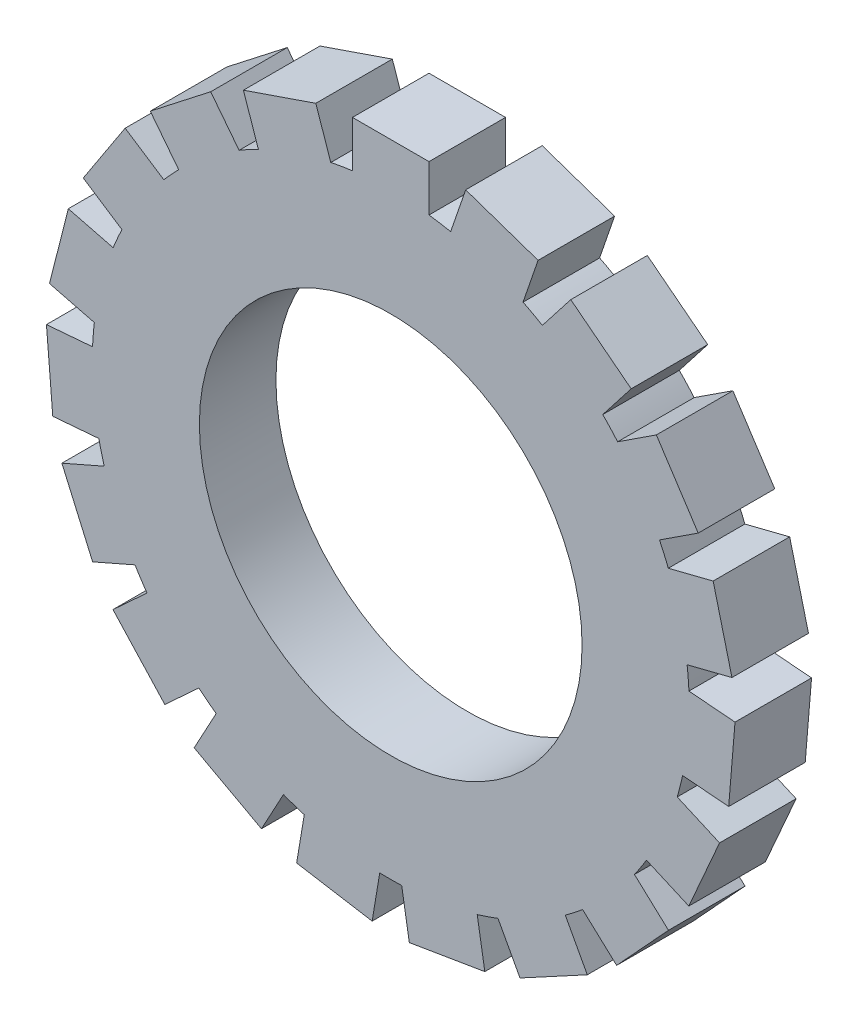
from build123d import *

# Parameters (mm, degrees)
SKETCH1_R           = 39
SKETCH1_R_2         = 25
BOSS_EXTRUDE1_DEPTH = 10


with BuildPart() as part:
    # Sketch1 → Boss-Extrude1 (new body)
    # profile 1 of 20: a face of its own
    with BuildSketch(Plane.XY):
        Circle(SKETCH1_R)
        Circle(SKETCH1_R_2, mode=Mode.SUBTRACT)
    # profile 2 of 20: a face of its own
    with BuildSketch(Plane.XY):
        with BuildLine():
            ThreePointArc((-38.722045261, 4.647925426), (-37.806610372, 9.573933998), (-36.26719039, 14.341928085))
            Line((-36.26719039, 14.341928085), (-42.125470405, 15.825446064))
            Line((-42.125470405, 15.825446064), (-44.580325277, 6.131443405))
            Line((-44.580325277, 6.131443405), (-38.722045261, 4.647925426))
        make_face()
    # profile 3 of 20: a face of its own
    with BuildSketch(Plane.XY):
        with BuildLine():
            ThreePointArc((-35.114799123, 16.969115549), (-32.649492652, 21.330978167), (-29.645317542, 25.340780332))
            Line((-29.645317542, 25.340780332), (-34.704482287, 28.646097626))
            Line((-34.704482287, 28.646097626), (-40.173963868, 20.274432843))
            Line((-40.173963868, 20.274432843), (-35.114799123, 16.969115549))
        make_face()
    # profile 4 of 20: a face of its own
    with BuildSketch(Plane.XY):
        with BuildLine():
            ThreePointArc((-27.702319638, 27.451438699), (-23.954295795, 30.776479866), (-19.810914544, 33.593565826))
            Line((-19.810914544, 33.593565826), (-23.522725017, 38.36250002))
            Line((-23.522725017, 38.36250002), (-31.414130111, 32.220372893))
            Line((-31.414130111, 32.220372893), (-27.702319638, 27.451438699))
        make_face()
    # profile 5 of 20: a face of its own
    with BuildSketch(Plane.XY):
        with BuildLine():
            ThreePointArc((-17.287863974, 34.958972514), (-12.663279299, 36.886872426), (-7.829691557, 38.205967206))
            Line((-7.829691557, 38.205967206), (-9.791915499, 43.921730281))
            Line((-9.791915499, 43.921730281), (-19.250087916, 40.674735589))
            Line((-19.250087916, 40.674735589), (-17.287863974, 34.958972514))
        make_face()
    # profile 6 of 20: a face of its own
    with BuildSketch(Plane.XY):
        with BuildLine():
            Line((9.791915499, 43.921730281), (7.829691557, 38.205967206))
            ThreePointArc((7.829691557, 38.205967206), (12.663279299, 36.886872426), (17.287863974, 34.958972514))
            Line((17.287863974, 34.958972514), (19.250087916, 40.674735589))
            Line((19.250087916, 40.674735589), (9.791915499, 43.921730281))
        make_face()
    # profile 7 of 20: a face of its own
    with BuildSketch(Plane.XY):
        with BuildLine():
            Line((5, 44.72135955), (-5, 44.72135955))
            Line((-5, 44.72135955), (-5, 38.678159212))
            ThreePointArc((-5, 38.678159212), (0, 39), (5, 38.678159212))
            Line((5, 38.678159212), (5, 44.72135955))
        make_face()
    # profile 8 of 20: a face of its own
    with BuildSketch(Plane.XY):
        with BuildLine():
            Line((23.522725017, 38.36250002), (19.810914544, 33.593565826))
            ThreePointArc((19.810914544, 33.593565826), (23.954295795, 30.776479866), (27.702319638, 27.451438699))
            Line((27.702319638, 27.451438699), (31.414130111, 32.220372893))
            Line((31.414130111, 32.220372893), (23.522725017, 38.36250002))
        make_face()
    # profile 9 of 20: a face of its own
    with BuildSketch(Plane.XY):
        with BuildLine():
            Line((34.704482287, 28.646097626), (29.645317542, 25.340780332))
            ThreePointArc((29.645317542, 25.340780332), (32.649492652, 21.330978167), (35.114799123, 16.969115549))
            Line((35.114799123, 16.969115549), (40.173963868, 20.274432843))
            Line((40.173963868, 20.274432843), (34.704482287, 28.646097626))
        make_face()
    # profile 10 of 20: a face of its own
    with BuildSketch(Plane.XY):
        with BuildLine():
            Line((42.125470405, 15.825446064), (36.26719039, 14.341928085))
            ThreePointArc((36.26719039, 14.341928085), (37.806610372, 9.573933998), (38.722045261, 4.647925426))
            Line((38.722045261, 4.647925426), (44.580325277, 6.131443405))
            Line((44.580325277, 6.131443405), (42.125470405, 15.825446064))
        make_face()
    # profile 11 of 20: a face of its own
    with BuildSketch(Plane.XY):
        with BuildLine():
            Line((44.981510161, 1.289861865), (38.958950416, 1.788905393))
            ThreePointArc((38.958950416, 1.788905393), (38.989736253, 0.894688154), (39, 0))
            ThreePointArc((39, 0), (38.782683774, -4.111379241), (38.133156961, -8.176939537))
            Line((38.133156961, -8.176939537), (44.155716706, -8.675983065))
            Line((44.155716706, -8.675983065), (44.981510161, 1.289861865))
        make_face()
    # profile 12 of 20: a face of its own
    with BuildSketch(Plane.XY):
        with BuildLine():
            Line((42.963105331, -13.385498882), (37.428903653, -10.957972956))
            ThreePointArc((37.428903653, -10.957972956), (35.71515974, -15.666121561), (33.411949407, -20.115706223))
            Line((33.411949407, -20.115706223), (38.946151084, -22.543232149))
            Line((38.946151084, -22.543232149), (42.963105331, -13.385498882))
        make_face()
    # profile 13 of 20: a face of its own
    with BuildSketch(Plane.XY):
        with BuildLine():
            Line((36.288981397, -26.610333128), (31.842854411, -22.517384905))
            ThreePointArc((31.842854411, -22.517384905), (28.693232516, -26.413981293), (25.070038695, -29.874624012))
            Line((25.070038695, -29.874624012), (29.516165681, -33.967572235))
            Line((29.516165681, -33.967572235), (36.288981397, -26.610333128))
        make_face()
    # profile 14 of 20: a face of its own
    with BuildSketch(Plane.XY):
        with BuildLine():
            ThreePointArc((-38.133156961, -8.176939537), (-38.866795227, -3.220594473), (-38.958950416, 1.788905393))
            Line((-38.958950416, 1.788905393), (-44.981510161, 1.289861865))
            Line((-44.981510161, 1.289861865), (-44.155716706, -8.675983065))
            Line((-44.155716706, -8.675983065), (-38.133156961, -8.176939537))
        make_face()
    # profile 15 of 20: a face of its own
    with BuildSketch(Plane.XY):
        with BuildLine():
            ThreePointArc((-33.411949407, -20.115706223), (-35.71515974, -15.666121561), (-37.428903653, -10.957972956))
            Line((-37.428903653, -10.957972956), (-42.963105331, -13.385498882))
            Line((-42.963105331, -13.385498882), (-38.946151084, -22.543232149))
            Line((-38.946151084, -22.543232149), (-33.411949407, -20.115706223))
        make_face()
    # profile 16 of 20: a face of its own
    with BuildSketch(Plane.XY):
        with BuildLine():
            ThreePointArc((-25.070038695, -29.874624012), (-28.693232516, -26.413981293), (-31.842854411, -22.517384905))
            Line((-31.842854411, -22.517384905), (-36.288981397, -26.610333128))
            Line((-36.288981397, -26.610333128), (-29.516165681, -33.967572235))
            Line((-29.516165681, -33.967572235), (-25.070038695, -29.874624012))
        make_face()
    # profile 17 of 20: a face of its own
    with BuildSketch(Plane.XY):
        with BuildLine():
            ThreePointArc((-14.011400288, -36.396162737), (-18.561948328, -34.299476297), (-22.8061378, -31.636688806))
            Line((-22.8061378, -31.636688806), (-25.682383247, -36.951524877))
            Line((-25.682383247, -36.951524877), (-16.887645735, -41.710998808))
            Line((-16.887645735, -41.710998808), (-14.011400288, -36.396162737))
        make_face()
    # profile 18 of 20: a face of its own
    with BuildSketch(Plane.XY):
        with BuildLine():
            ThreePointArc((-1.434409251, -38.973612485), (-6.419189021, -38.468090833), (-11.298022285, -37.327666582))
            Line((-11.298022285, -37.327666582), (-12.292700369, -43.288445544))
            Line((-12.292700369, -43.288445544), (-2.429087335, -44.934391447))
            Line((-2.429087335, -44.934391447), (-1.434409251, -38.973612485))
        make_face()
    # profile 19 of 20: a face of its own
    with BuildSketch(Plane.XY):
        with BuildLine():
            Line((12.292700369, -43.288445544), (11.298022285, -37.327666582))
            ThreePointArc((11.298022285, -37.327666582), (6.419189021, -38.468090833), (1.434409251, -38.973612485))
            Line((1.434409251, -38.973612485), (2.429087335, -44.934391447))
            Line((2.429087335, -44.934391447), (12.292700369, -43.288445544))
        make_face()
    # profile 20 of 20: a face of its own
    with BuildSketch(Plane.XY):
        with BuildLine():
            Line((25.682383247, -36.951524877), (22.8061378, -31.636688806))
            ThreePointArc((22.8061378, -31.636688806), (18.561948328, -34.299476297), (14.011400288, -36.396162737))
            Line((14.011400288, -36.396162737), (16.887645735, -41.710998808))
            Line((16.887645735, -41.710998808), (25.682383247, -36.951524877))
        make_face()
    extrude(amount=BOSS_EXTRUDE1_DEPTH)


solid = part.part
